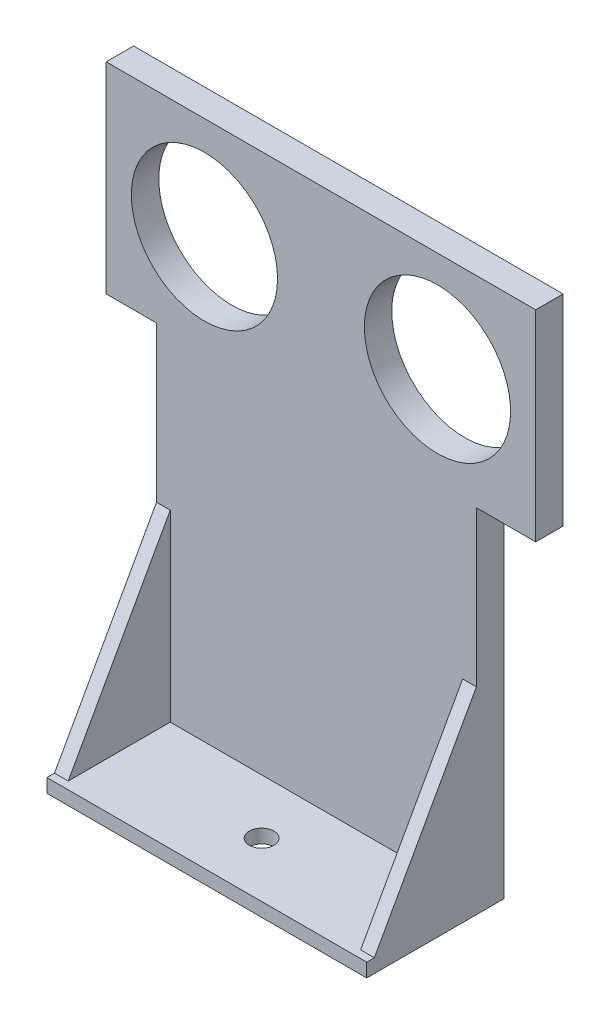
from build123d import *

# Parameters (mm, degrees)
BOSS_EXTRUDE3_DEPTH = 1.5
BOSS_EXTRUDE4_DEPTH = 1.5
SKETCH2_W           = 35
SKETCH2_H           = 12
SKETCH2_R           = 1.35
BOSS_EXTRUDE7_DEPTH = 1.5
SKETCH3_R           = 8
BOSS_EXTRUDE8_DEPTH = 3


with BuildPart() as part:
    # Sketch5 → Boss-Extrude3 (new body)
    with BuildSketch(Plane(origin=(-17.5, 0, 0), x_dir=(0, 1, 0), z_dir=(-1, 0, 0))):
        Polygon((21.59, 6), (0, -6), (0, 6), align=None)
    extrude(amount=-BOSS_EXTRUDE3_DEPTH)



with BuildPart() as body_2:
    # Sketch4 → Boss-Extrude4 (new body)
    with BuildSketch(Plane(origin=(17.5, 0, 0), x_dir=(0, 0, -1), z_dir=(1, 0, 0))):
        Polygon((6, 21.592468158), (-6, 0), (6, 0), align=None)
    extrude(amount=-BOSS_EXTRUDE4_DEPTH)


with BuildPart() as part_1:
    add(part.part)

    add(body_2.part)  # Boss-Extrude7 merges body 2
    # Sketch2 → Boss-Extrude7 (add)
    with BuildSketch(Plane(origin=(0, 0, 0), x_dir=(1, 0, 0), z_dir=(0, 1, 0))):
        Rectangle(SKETCH2_W, SKETCH2_H)
        with Locations(Location((0, 0, 0), (0, 0, 270))):
            Circle(SKETCH2_R, mode=Mode.SUBTRACT)
    extrude(amount=BOSS_EXTRUDE7_DEPTH)

    # Sketch3 → Boss-Extrude8 (add)
    with BuildSketch(Plane(origin=(0, 0, -6), x_dir=(-1, 0, 0), z_dir=(0, 0, -1))):
        Polygon((17.5, 0), (-17.5, 0), (-17.5, 38.573665286), (-23.990187259, 38.573665286), (-23.990187259, 60.573665286), (23.009812741, 60.573665286), (23.009812741, 38.573665286), (17.5, 38.573665286), align=None)
        with Locations((-13.240187259, 49.573665286)):
            Circle(SKETCH3_R, mode=Mode.SUBTRACT)
        with Locations(Location((12.259812741, 49.37459891, 0), (0, 0, 180))):
            Circle(SKETCH3_R, mode=Mode.SUBTRACT)
    extrude(amount=BOSS_EXTRUDE8_DEPTH)


solid = part_1.part
